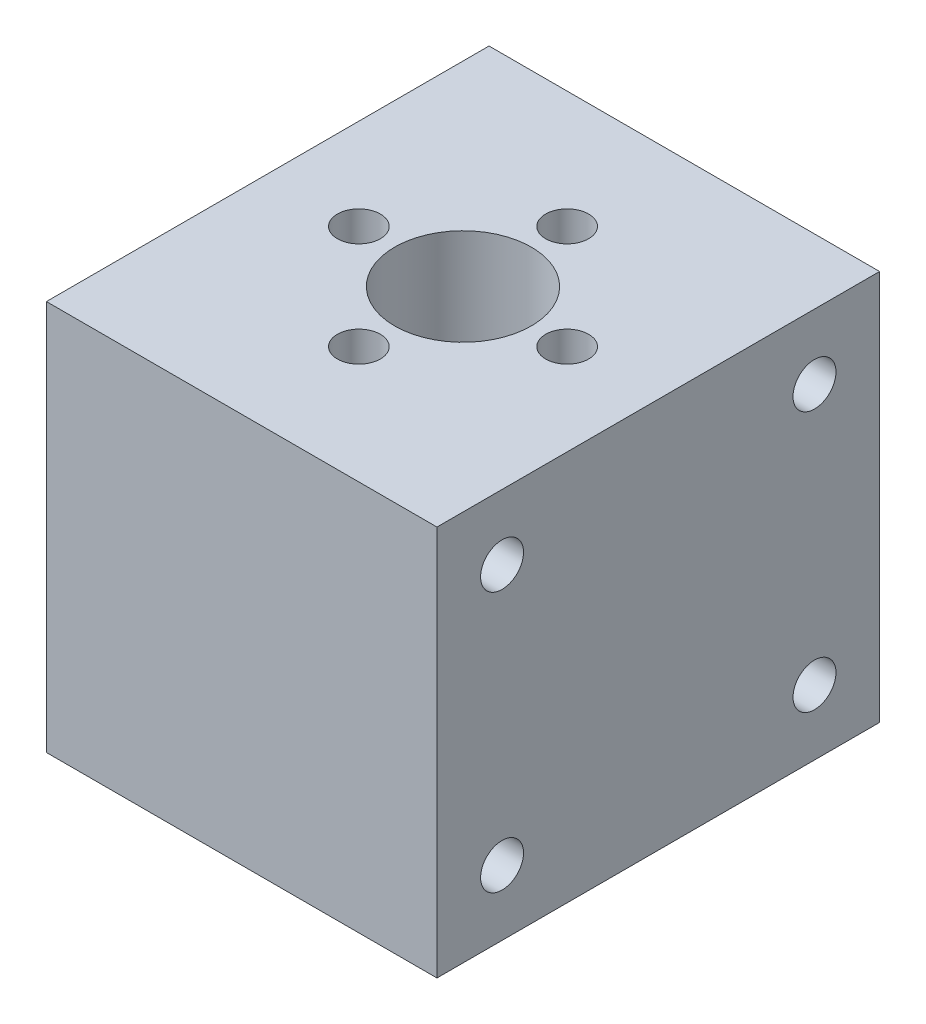
from build123d import *

# Parameters (mm, degrees)
SKETCH_1_W          = 30
SKETCH_1_H          = 34
EXTRUDE_1_DEPTH     = 30
HOLE_WIZARD_1_D     = 3.3
HOLE_WIZARD_1_DEPTH = 10
HOLE_WIZARD_2_D     = 3.3
HOLE_WIZARD_2_DEPTH = 10
HOLE_WIZARD_3_D     = 10.5


with BuildPart() as part:
    # 草图1 → 凸台-拉伸1 (new body)
    with BuildSketch(Plane(origin=(0, 0, 0), x_dir=(1, 0, 0), z_dir=(0, 1, 0))):
        with Locations((15, 17)):
            Rectangle(SKETCH_1_W, SKETCH_1_H)
    extrude(amount=EXTRUDE_1_DEPTH)

    # 孔1
    with Locations(Plane(origin=(30, 0, 0), x_dir=(0, 0, -1), z_dir=(1, 0, 0))):
        with Locations((5, 25), (29, 25), (5, 5), (29, 5)):
            Hole(HOLE_WIZARD_1_D / 2, depth=HOLE_WIZARD_1_DEPTH)

    # 孔2
    with Locations(Plane(origin=(0, 30, 0), x_dir=(1, 0, 0), z_dir=(0, 1, 0))):
        with Locations((7, 17), (15, 25), (23, 17), (15, 9)):
            Hole(HOLE_WIZARD_2_D / 2, depth=HOLE_WIZARD_2_DEPTH)

    # 孔3 (through all)
    with Locations(Plane(origin=(0, 30, 0), x_dir=(1, 0, 0), z_dir=(0, 1, 0))):
        with Locations((15, 17)):
            Hole(HOLE_WIZARD_3_D / 2)


solid = part.part
